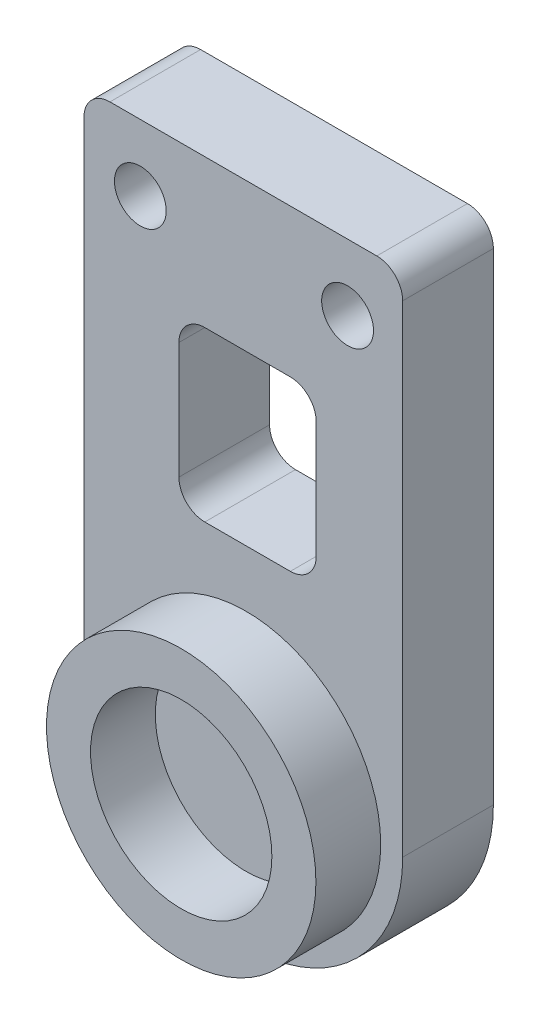
from build123d import *

# Parameters (mm, degrees)
SKETCH2_W           = 12.3
SKETCH2_H           = 25.6
BOSS_EXTRUDE2_DEPTH = 3.5
SKETCH3_R           = 1
SKETCH3_W           = 5.3
SKETCH3_H           = 6.5
CUT_EXTRUDE1_DEPTH  = 3.5
FILLET1_R           = 1
FILLET2_R           = 6
SKETCH4_R           = 5.2
SKETCH4_R_2         = 3.5
BOSS_EXTRUDE3_DEPTH = 2.5


with BuildPart() as part:
    # Sketch2 → Boss-Extrude2 (new body)
    with BuildSketch(Plane.XY.offset(8)):
        with Locations((-295.104618969, 227.705749953)):
            Rectangle(SKETCH2_W, SKETCH2_H)
    extrude(amount=BOSS_EXTRUDE2_DEPTH)

    # Sketch3 → Cut-Extrude1 (cut)
    with BuildSketch(Plane.XY.offset(11.5)):
        with Locations((-299.082028179, 237.944260964)):
            Circle(SKETCH3_R)
        with Locations((-291.082028179, 237.944260964)):
            Circle(SKETCH3_R)
        with Locations((-294.942907715, 231.542892456)):
            Rectangle(SKETCH3_W, SKETCH3_H)
    extrude(amount=-CUT_EXTRUDE1_DEPTH, mode=Mode.SUBTRACT)

    # Fillet1
    fillet1_edges = [part.edges().sort_by_distance(p)[0] for p in [
        (-297.592907715, 228.292892456, 9.75),
        (-297.592907715, 234.792892456, 9.75),
        (-292.292907715, 234.792892456, 9.75),
        (-292.292907715, 228.292892456, 9.75),
        (-301.254618969, 240.505749953, 9.75),
        (-288.954618969, 240.505749953, 9.75),
    ]]
    fillet(fillet1_edges, radius=FILLET1_R)

    # Fillet2
    fillet2_edges = [part.edges().sort_by_distance(p)[0] for p in [
        (-288.954618969, 214.905749953, 9.75),
        (-301.254618969, 214.905749953, 9.75),
    ]]
    fillet(fillet2_edges, radius=FILLET2_R)

    # Sketch4 → Boss-Extrude3 (add)
    with BuildSketch(Plane.XY.offset(11.5)):
        with Locations((-295.004474021, 220.905749953)):
            Circle(SKETCH4_R)
        with Locations((-295.004474021, 220.905749953)):
            Circle(SKETCH4_R_2, mode=Mode.SUBTRACT)
    extrude(amount=BOSS_EXTRUDE3_DEPTH)


solid = part.part
